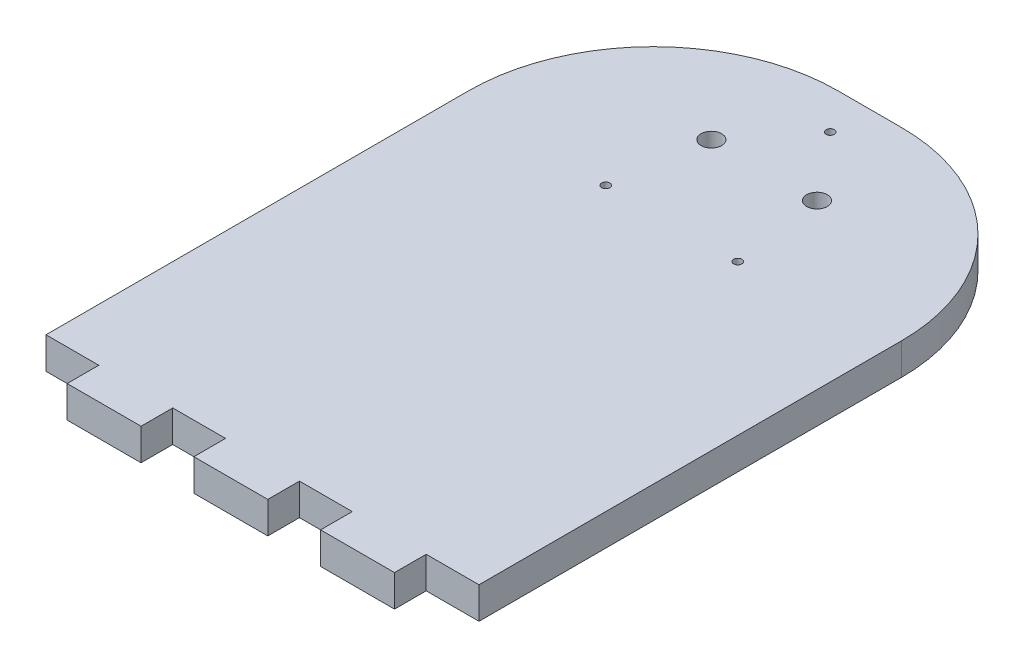
from build123d import *

# Parameters (mm, degrees)
SALIENTE_EXTRUIR1_DEPTH = 12
CROQUIS2_R              = 1.55
CROQUIS2_R_2            = 3.9
CORTAR_EXTRUIR1_DEPTH   = 12
REDONDEO1_R             = 70


with BuildPart() as part:
    # Croquis1 → Saliente-Extruir1 (new body)
    with BuildSketch(Plane(origin=(0, 0, 0), x_dir=(1, 0, 0), z_dir=(0, 1, 0))):
        Polygon((0, 0), (20, 0), (20, -12), (48, -12), (48, 0), (68, 0), (68, -12), (96, -12), (96, 0), (116, 0), (116, -12), (144, -12), (144, 0), (164, 0), (164, 230), (0, 230), align=None)
    extrude(amount=SALIENTE_EXTRUIR1_DEPTH)

    # Croquis2 → Cortar-Extruir1 (cut)
    with BuildSketch(Plane(origin=(0, 12, 0), x_dir=(1, 0, 0), z_dir=(0, 1, 0))):
        with Locations(Location((82, 215, 0), (0, 0, 270))):
            Circle(CROQUIS2_R)
        with Locations(Location((57, 155, 0), (0, 0, 270))):
            Circle(CROQUIS2_R)
        with Locations(Location((107, 155, 0), (0, 0, 270))):
            Circle(CROQUIS2_R)
        with Locations(Location((62, 190, 0), (0, 0, 270))):
            Circle(CROQUIS2_R_2)
        with Locations(Location((102, 190, 0), (0, 0, 270))):
            Circle(CROQUIS2_R_2)
    extrude(amount=-CORTAR_EXTRUIR1_DEPTH, mode=Mode.SUBTRACT)

    # Redondeo1
    redondeo1_edges = [part.edges().sort_by_distance(p)[0] for p in [
        (164, 6, -230),
        (0, 6, -230),
    ]]
    fillet(redondeo1_edges, radius=REDONDEO1_R)


solid = part.part
